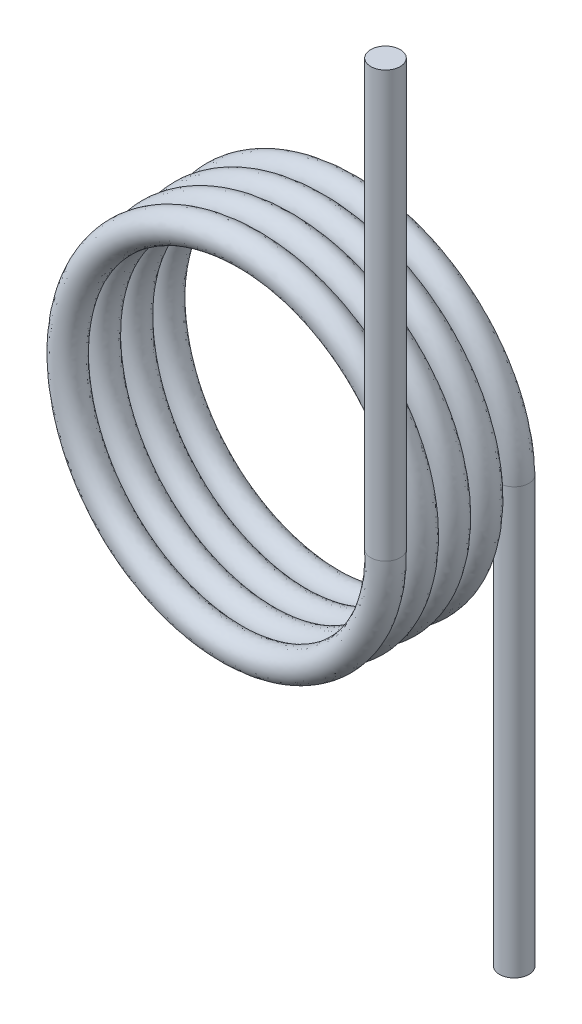
from build123d import *

# Parameters (mm, degrees)
SWEEP1_PITCH        = 0.491666667
SWEEP1_HEIGHT       = 1.966666667
SWEEP1_RADIUS       = 2.55
SWEEP1_START_ANGLE  = -180
SKETCH2_R           = 0.225
SKETCH4_R           = 0.225
BOSS_EXTRUDE1_DEPTH = 6.5
SKETCH5_R           = 0.225
BOSS_EXTRUDE2_DEPTH = 6.5


with BuildPart() as part:
    # Sweep1: sweep along a helix
    with BuildLine() as sweep1_path:
        add(Helix(SWEEP1_PITCH, SWEEP1_HEIGHT, SWEEP1_RADIUS, center=(0, 0, 0), direction=(0, 0, -1), mode=Mode.PRIVATE).rotate(Axis((0, 0, 0), (0, 0, -1)), SWEEP1_START_ANGLE))
    # Sketch2 → Sweep1 (sweep)
    with BuildSketch(Plane(origin=(0, 0, 0), x_dir=(1, 0, 0), z_dir=(0, 1, 0))):
        with Locations((2.55, 0)):
            Circle(SKETCH2_R)
    sweep(path=sweep1_path.line, is_frenet=True)

    # Sketch4 → Boss-Extrude1 (add)
    with BuildSketch(Plane.XZ):
        with Locations(Location((2.55, -1.966666667, 0), (0, 0, 90))):
            Circle(SKETCH4_R)
    extrude(amount=BOSS_EXTRUDE1_DEPTH)

    # Sketch5 → Boss-Extrude2 (add)
    with BuildSketch(Plane(origin=(0, 0, 0), x_dir=(1, 0, 0), z_dir=(0, 1, 0))):
        with Locations(Location((2.55, 0, 0), (0, 0, 270))):
            Circle(SKETCH5_R)
    extrude(amount=BOSS_EXTRUDE2_DEPTH)


solid = part.part
